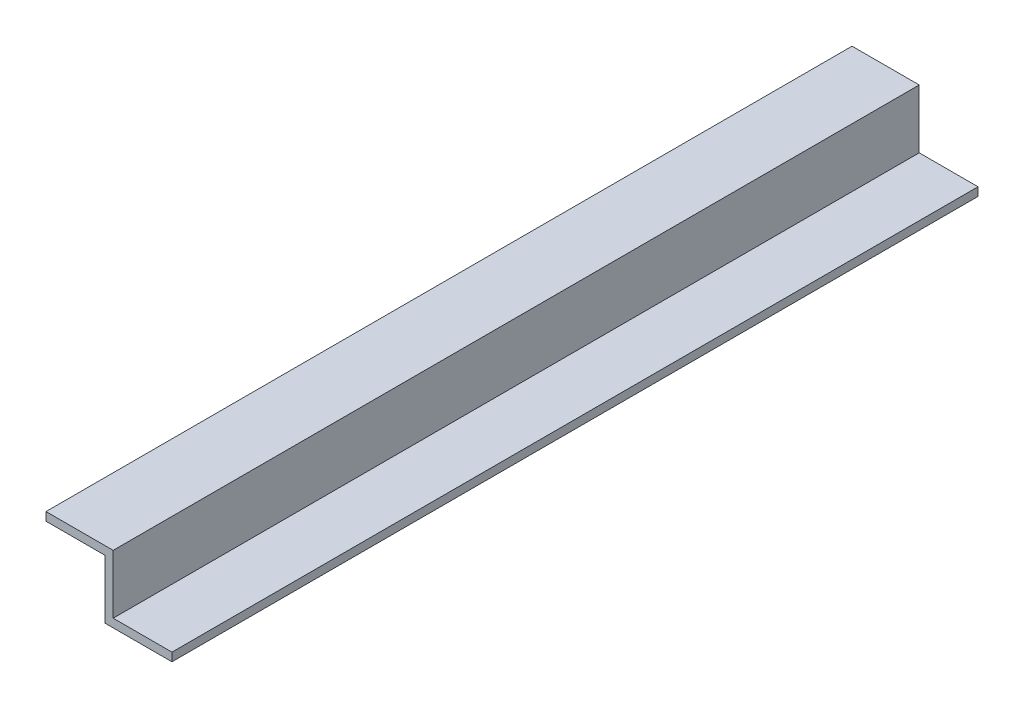
from build123d import *

# Parameters (mm, degrees)
BOSS_EXTRUDE1_DEPTH      = 152.4
BOSS_EXTRUDE1_DEPTH_BACK = 152.4


with BuildPart() as part:
    # Sketch3 → Boss-Extrude1 (new, two sides: drawn at the far end of the back side and taken through both)
    with BuildSketch(Plane.XY.offset(-BOSS_EXTRUDE1_DEPTH_BACK)):
        Polygon((23.8125, -9.525), (23.8125, -12.7), (-1.5875, -12.7), (-1.5875, 9.525), (-23.8125, 9.525), (-23.8125, 12.7), (1.5875, 12.7), (1.5875, -9.525), align=None)
    extrude(amount=BOSS_EXTRUDE1_DEPTH + BOSS_EXTRUDE1_DEPTH_BACK)


solid = part.part
